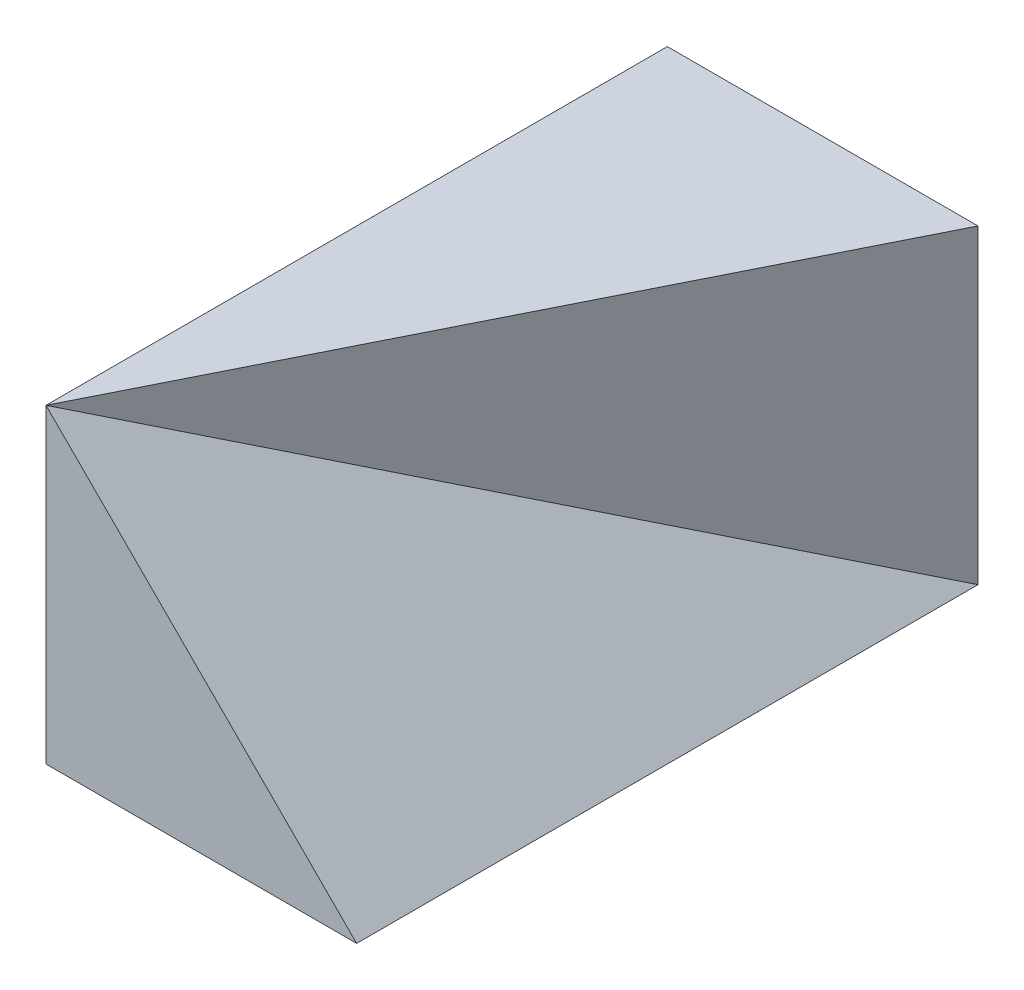
from build123d import *

# Parameters (mm, degrees)
SKETCH1_W           = 50
SKETCH1_H           = 50
BOSS_EXTRUDE1_DEPTH = 50
CUT_EXTRUDE1_DEPTH  = 100


with BuildPart() as part:
    # Sketch1 → Boss-Extrude1 (new, symmetric)
    with BuildSketch(Plane.XY):
        Rectangle(SKETCH1_W, SKETCH1_H)
    extrude(amount=BOSS_EXTRUDE1_DEPTH, both=True)

    # 3DSketch1 → Cut-Extrude1 (cut, along a direction that is not the sketch's normal)
    with BuildSketch(Plane(origin=(-25, 25, 50), x_dir=(0.408248290463863, -0.408248290463863, -0.816496580927726), z_dir=(-0.7071067811865476, -0.7071067811865476, 0))):
        Polygon((0, 0), (122.474487139, 0), (40.824829046, 57.735026919), align=None)
    extrude(amount=-CUT_EXTRUDE1_DEPTH, dir=(0, -1, 0), mode=Mode.SUBTRACT)


solid = part.part
